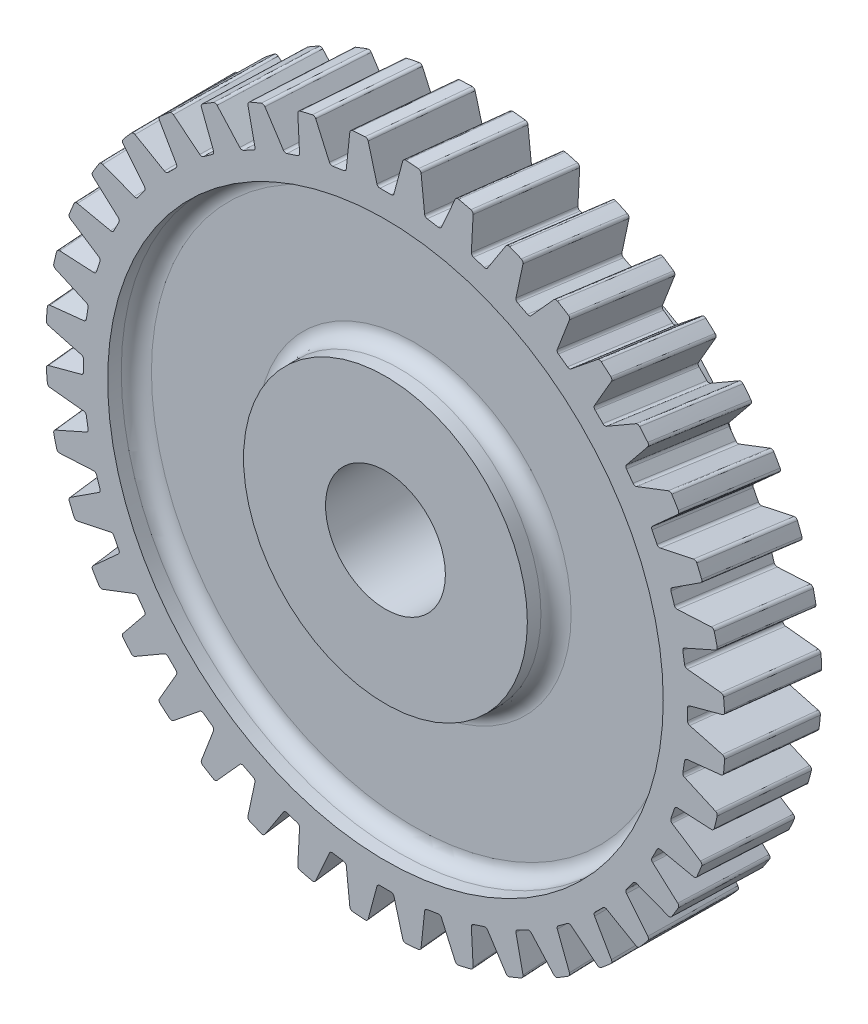
from build123d import *

# Parameters (mm, degrees)
FILLET1_R         = 1
CIRPATTERN1_COUNT = 40
FILLET2_R         = 0.2


with BuildPart() as part:
    # Sketch2 → Revolve1 (revolve)
    with BuildSketch(Plane(origin=(0, 0, 0), x_dir=(0, 0, -1), z_dir=(1, 0, 0)), mode=Mode.PRIVATE) as revolve1_sk:
        Polygon((11, 3.96875), (-3.2, 3.96875), (-3.2, 9.4), (-1.3, 9.4), (-1.3, 18.4), (-3.2, 18.4), (-3.2, 22.5), (3.2, 22.5), (3.2, 18.4), (1.3, 18.4), (1.3, 9.4), (3.2, 9.4), (11, 9.4), align=None)
    revolve(revolve1_sk.sketch.rotate(Axis((0, 0, 0), (0, 0, -1)), 90), axis=Axis((0, 0, 0), (0, 0, -1)))

    # Fillet1
    fillet1_edges = [part.edges().sort_by_distance(p)[0] for p in [
        (-18.4, 0, -1.3),
        (-18.4, 0, 1.3),
        (-9.4, 0, 1.3),
        (-9.4, 0, -1.3),
    ]]
    fillet(fillet1_edges, radius=FILLET1_R)

    # Cut-Sweep1: sweep along a path in Sketch4
    with BuildLine(Plane(origin=(0, 0, 0), x_dir=(1, 0, 0), z_dir=(0, 1, 0))) as cut_sweep1_path:
        Line((0, -3.2), (0.690971205, 3.2))
    # Sketch3 → Cut-Sweep1 (sweep, cut)
    with BuildSketch(Plane.XY.offset(3.2)):
        Polygon((-0.525, 20), (0.525, 20), (1.246362285, 22.6921607), (-1.246362285, 22.6921607), align=None)
    cut_sweep1 = sweep(path=cut_sweep1_path.line, mode=Mode.SUBTRACT)

    # CirPattern1: Cut-Sweep1 ×40 about axis
    cirpattern1_axis = Axis((0, 0, 0), (0, 0, 1))
    for i in range(1, CIRPATTERN1_COUNT):
        add(cut_sweep1.rotate(cirpattern1_axis, i * 360 / CIRPATTERN1_COUNT), mode=Mode.SUBTRACT)

    # Fillet2
    fillet2_edges = [part.edges().sort_by_distance(p)[0] for p in [
        (-10.960590953, 19.649820507, -6.2808e-05),
        (-9.239758494, 17.738632653, 0),
        (-8.831163565, 20.694456989, 5.3054e-05),
        (-8.304201644, 18.215322678, 0),
        (-13.89955705, 17.693284427, -6.2808e-05),
        (-11.900935244, 16.074823972, 0),
        (-11.959763596, 19.058175535, 5.3054e-05),
        (-11.0514674, 16.691998487, 0),
        (-16.496269922, 15.301080964, -6.2808e-05),
        (-14.269071471, 14.015199776, 0),
        (-14.793874554, 16.952618549, 5.3054e-05),
        (-13.526609351, 14.757661896, 0),
        (-18.68678988, 12.532114106, -6.2808e-05),
        (-16.285855803, 11.610474848, 0),
        (-17.263711223, 14.429631832, 5.3054e-05),
        (-15.668681288, 12.459942692, 0),
        (-20.417179054, 9.454565008, -6.2808e-05),
        (-17.901628315, 8.919861496, 0),
        (-19.308458027, 11.55133969, 5.3054e-05),
        (-17.42493829, 9.855418346, 0),
        (-21.644829518, 6.144213141, -6.2808e-05),
        (-19.076603325, 6.00961155, 0),
        (-20.877766513, 8.388615227, 5.3054e-05),
        (-18.752135481, 7.008220892, 0),
        (-22.339512445, 2.682570354, -6.2808e-05),
        (-19.781849051, 2.951385024, 0),
        (-21.932995098, 5.019335218, 5.3054e-05),
        (-19.617592862, 3.988457781, 0),
        (-22.484122435, -0.845126217, -6.2808e-05),
        (-20, -0.179514397, 0),
        (-22.448160552, 1.526462518, 5.3054e-05),
        (-20, 0.870485603, 0),
        (-22.07509871, -4.352012976, -6.2808e-05),
        (-19.725684573, -3.305993578, 0),
        (-22.410577793, -2.003996756, 5.3054e-05),
        (-19.889940761, -2.26892082, 0),
        (-21.122512792, -7.751738732, -6.2808e-05),
        (-18.965657326, -6.351068225, 0),
        (-21.821172231, -5.485110979, 5.3054e-05),
        (-19.29012517, -5.352458883, 0),
        (-19.649820507, -10.960590953, -6.2808e-05),
        (-17.738632653, -9.239758494, 0),
        (-20.694456989, -8.831163565, 5.3054e-05),
        (-18.215322678, -8.304201644, 0),
        (-17.693284427, -13.89955705, -6.2808e-05),
        (-16.074823972, -11.900935244, 0),
        (-19.058175535, -11.959763596, 5.3054e-05),
        (-16.691998487, -11.0514674, 0),
        (-15.301080964, -16.496269922, -6.2808e-05),
        (-14.015199776, -14.269071471, 0),
        (-16.952618549, -14.793874554, 5.3054e-05),
        (-14.757661896, -13.526609351, 0),
        (-12.532114106, -18.68678988, -6.2808e-05),
        (-11.610474848, -16.285855803, 0),
        (-14.429631832, -17.263711223, 5.3054e-05),
        (-12.459942692, -15.668681288, 0),
        (-9.454565008, -20.417179054, -6.2808e-05),
        (-8.919861496, -17.901628315, 0),
        (-11.55133969, -19.308458027, 5.3054e-05),
        (-9.855418346, -17.42493829, 0),
        (-6.144213141, -21.644829518, -6.2808e-05),
        (-6.00961155, -19.076603325, 0),
        (-8.388615227, -20.877766513, 5.3054e-05),
        (-7.008220892, -18.752135481, 0),
        (-2.682570354, -22.339512445, -6.2808e-05),
        (-2.951385024, -19.781849051, 0),
        (-5.019335218, -21.932995098, 5.3054e-05),
        (-3.988457781, -19.617592862, 0),
        (0.845126217, -22.484122435, -6.2808e-05),
        (0.179514397, -20, 0),
        (-1.526462518, -22.448160552, 5.3054e-05),
        (-0.870485603, -20, 0),
        (4.352012976, -22.07509871, -6.2808e-05),
        (3.305993578, -19.725684573, 0),
        (-0.845126217, 22.484122435, -6.2808e-05),
        (2.003996756, -22.410577793, 5.3054e-05),
        (2.26892082, -19.889940761, 0),
        (-0.179514397, 20, 0),
        (1.526462518, 22.448160552, 5.3054e-05),
        (7.751738732, -21.122512792, -6.2808e-05),
        (6.351068225, -18.965657326, 0),
        (5.485110979, -21.821172231, 5.3054e-05),
        (5.352458883, -19.29012517, 0),
        (0.870485603, 20, 0),
        (10.960590953, -19.649820507, -6.2808e-05),
        (9.239758494, -17.738632653, 0),
        (8.831163565, -20.694456989, 5.3054e-05),
        (8.304201644, -18.215322678, 0),
        (13.89955705, -17.693284427, -6.2808e-05),
        (11.900935244, -16.074823972, 0),
        (11.959763596, -19.058175535, 5.3054e-05),
        (11.0514674, -16.691998487, 0),
        (16.496269922, -15.301080964, -6.2808e-05),
        (14.269071471, -14.015199776, 0),
        (14.793874554, -16.952618549, 5.3054e-05),
        (13.526609351, -14.757661896, 0),
        (18.68678988, -12.532114106, -6.2808e-05),
        (16.285855803, -11.610474848, 0),
        (17.263711223, -14.429631832, 5.3054e-05),
        (15.668681288, -12.459942692, 0),
        (20.417179054, -9.454565008, -6.2808e-05),
        (17.901628315, -8.919861496, 0),
        (19.308458027, -11.55133969, 5.3054e-05),
        (17.42493829, -9.855418346, 0),
        (21.644829518, -6.144213141, -6.2808e-05),
        (19.076603325, -6.00961155, 0),
        (20.877766513, -8.388615227, 5.3054e-05),
        (18.752135481, -7.008220892, 0),
        (22.339512445, -2.682570354, -6.2808e-05),
        (19.781849051, -2.951385024, 0),
        (21.932995098, -5.019335218, 5.3054e-05),
        (19.617592862, -3.988457781, 0),
        (22.484122435, 0.845126217, -6.2808e-05),
        (20, 0.179514397, 0),
        (22.448160552, -1.526462518, 5.3054e-05),
        (20, -0.870485603, 0),
        (22.07509871, 4.352012976, -6.2808e-05),
        (19.725684573, 3.305993578, 0),
        (22.410577793, 2.003996756, 5.3054e-05),
        (19.889940761, 2.26892082, 0),
        (-4.352012976, 22.07509871, -6.2808e-05),
        (-3.305993578, 19.725684573, 0),
        (21.122512792, 7.751738732, -6.2808e-05),
        (-2.003996756, 22.410577793, 5.3054e-05),
        (18.965657326, 6.351068225, 0),
        (21.821172231, 5.485110979, 5.3054e-05),
        (19.29012517, 5.352458883, 0),
        (-2.26892082, 19.889940761, 0),
        (19.649820507, 10.960590953, -6.2808e-05),
        (17.738632653, 9.239758494, 0),
        (20.694456989, 8.831163565, 5.3054e-05),
        (18.215322678, 8.304201644, 0),
        (17.693284427, 13.89955705, -6.2808e-05),
        (16.074823972, 11.900935244, 0),
        (19.058175535, 11.959763596, 5.3054e-05),
        (16.691998487, 11.0514674, 0),
        (15.301080964, 16.496269922, -6.2808e-05),
        (14.015199776, 14.269071471, 0),
        (16.952618549, 14.793874554, 5.3054e-05),
        (14.757661896, 13.526609351, 0),
        (12.532114106, 18.68678988, -6.2808e-05),
        (11.610474848, 16.285855803, 0),
        (14.429631832, 17.263711223, 5.3054e-05),
        (12.459942692, 15.668681288, 0),
        (9.454565008, 20.417179054, -6.2808e-05),
        (8.919861496, 17.901628315, 0),
        (11.55133969, 19.308458027, 5.3054e-05),
        (9.855418346, 17.42493829, 0),
        (6.144213141, 21.644829518, -6.2808e-05),
        (6.00961155, 19.076603325, 0),
        (8.388615227, 20.877766513, 5.3054e-05),
        (7.008220892, 18.752135481, 0),
        (2.682570354, 22.339512445, -6.2808e-05),
        (2.951385024, 19.781849051, 0),
        (5.019335218, 21.932995098, 5.3054e-05),
        (3.988457781, 19.617592862, 0),
        (-7.751738732, 21.122512792, -6.2808e-05),
        (-6.351068225, 18.965657326, 0),
        (-5.485110979, 21.821172231, 5.3054e-05),
        (-5.352458883, 19.29012517, 0),
    ]]
    fillet(fillet2_edges, radius=FILLET2_R)


solid = part.part
